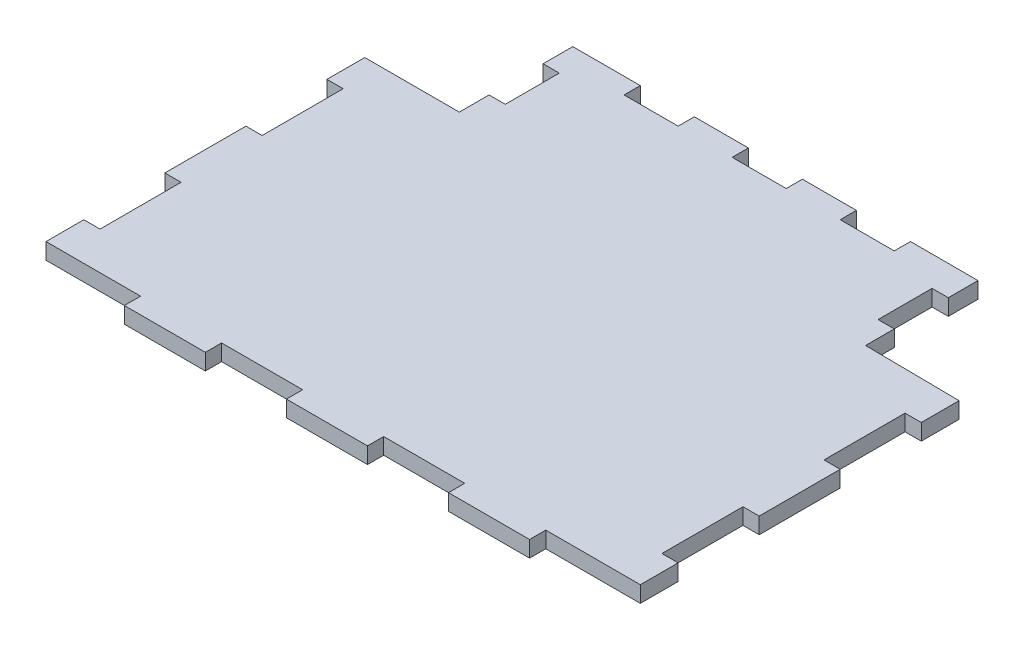
from build123d import *

# Parameters (mm, degrees)
SALIENTE_EXTRUIR1_DEPTH = 3


with BuildPart() as part:
    # Croquis1 → Saliente-Extruir1 (new body)
    with BuildSketch(Plane(origin=(0, 0, 0), x_dir=(1, 0, 0), z_dir=(0, 1, 0))):
        Polygon((0, 10), (0, 3), (17.5, 3), (17.5, 0), (32.5, 0), (32.5, 3), (47.5, 3), (47.5, 0), (55, 0), (62.5, 0), (62.5, 3), (77.5, 3), (77.5, 0), (92.5, 0), (92.5, 3), (110, 3), (110, 10), (107, 10), (107, 25), (110, 25), (110, 32.5), (110, 40), (107, 40), (107, 55), (110, 55), (110, 62), (92.5, 62.187777448), (92.5, 67.5), (89.5, 67.5), (89.5, 72.5), (89.5, 77.5), (92.5, 77.5), (92.5, 83), (80, 83), (80, 80), (70, 80), (70, 83), (60, 83), (60, 80), (50, 80), (50, 83), (40, 83), (40, 80), (30, 80), (30, 83), (17.5, 83), (17.5, 77.5), (20.5, 77.5), (20.5, 72.5), (20.5, 67.5), (17.5, 67.5), (17.5, 62), (0, 62), (0, 55), (3, 55), (3, 40), (0, 40), (0, 25), (3, 25), (3, 10), align=None)
    extrude(amount=SALIENTE_EXTRUIR1_DEPTH)


solid = part.part
